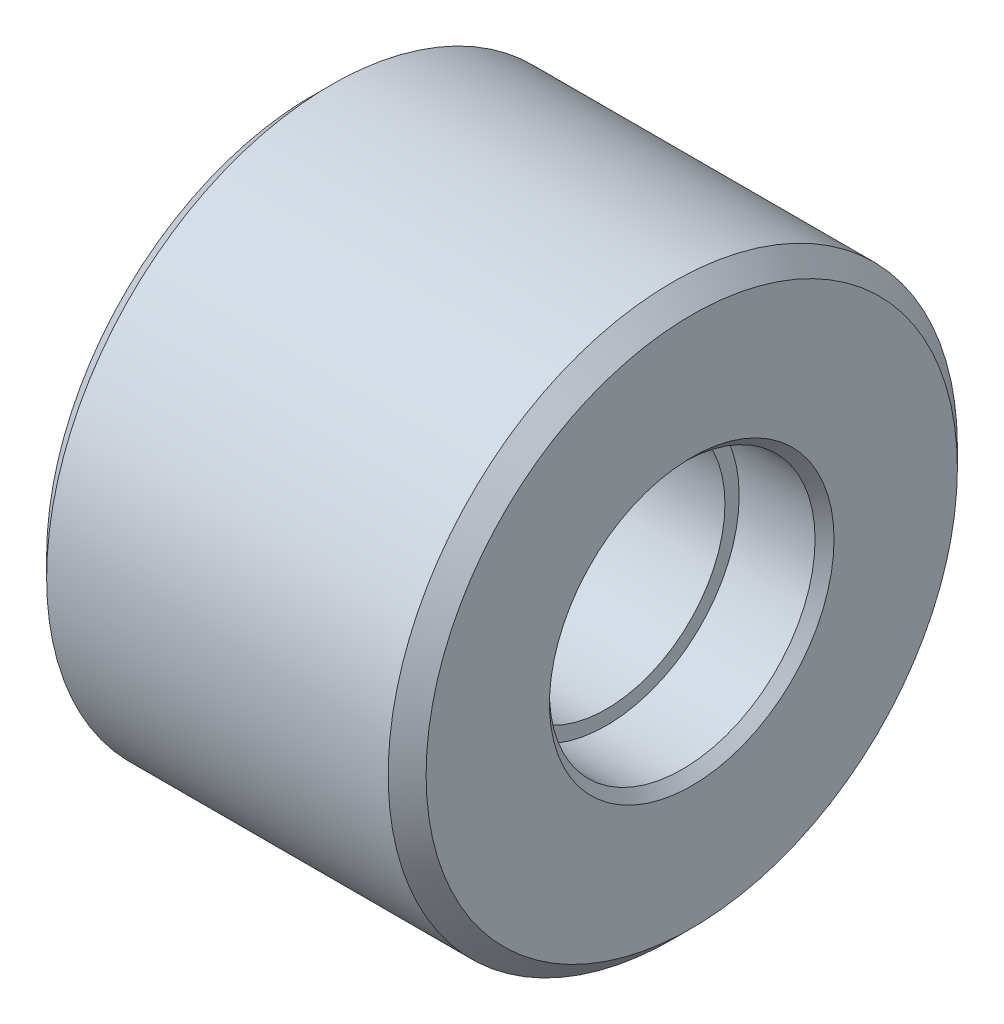
from build123d import *

# Parameters (mm, degrees)
CHAMFER_1_SIZE = 2
CHAMFER_2_SIZE = 1


with BuildPart() as part:
    # Эскиз1 → Повернуть1 (revolve)
    with BuildSketch(Plane.XY, mode=Mode.PRIVATE) as revolve_1_sk:
        Polygon((-20, 30), (20, 30), (20, 14), (11, 14), (11, 12.5), (-11, 12.5), (-11, 14), (-20, 14), align=None)
    revolve(revolve_1_sk.sketch.rotate(Axis((0, 0, 0), (-1, 0, 0)), 90), axis=Axis((0, 0, 0), (-1, 0, 0)))

    # Фаска1
    chamfer_1_edges = [part.edges().sort_by_distance(p)[0] for p in [
        (-20, 0, 30),
        (20, 0, 30),
    ]]
    chamfer(chamfer_1_edges, length=CHAMFER_1_SIZE)

    # Фаска2
    chamfer_2_edges = [part.edges().sort_by_distance(p)[0] for p in [
        (-20, 0, 14),
        (20, 0, 14),
    ]]
    chamfer(chamfer_2_edges, length=CHAMFER_2_SIZE)


solid = part.part
